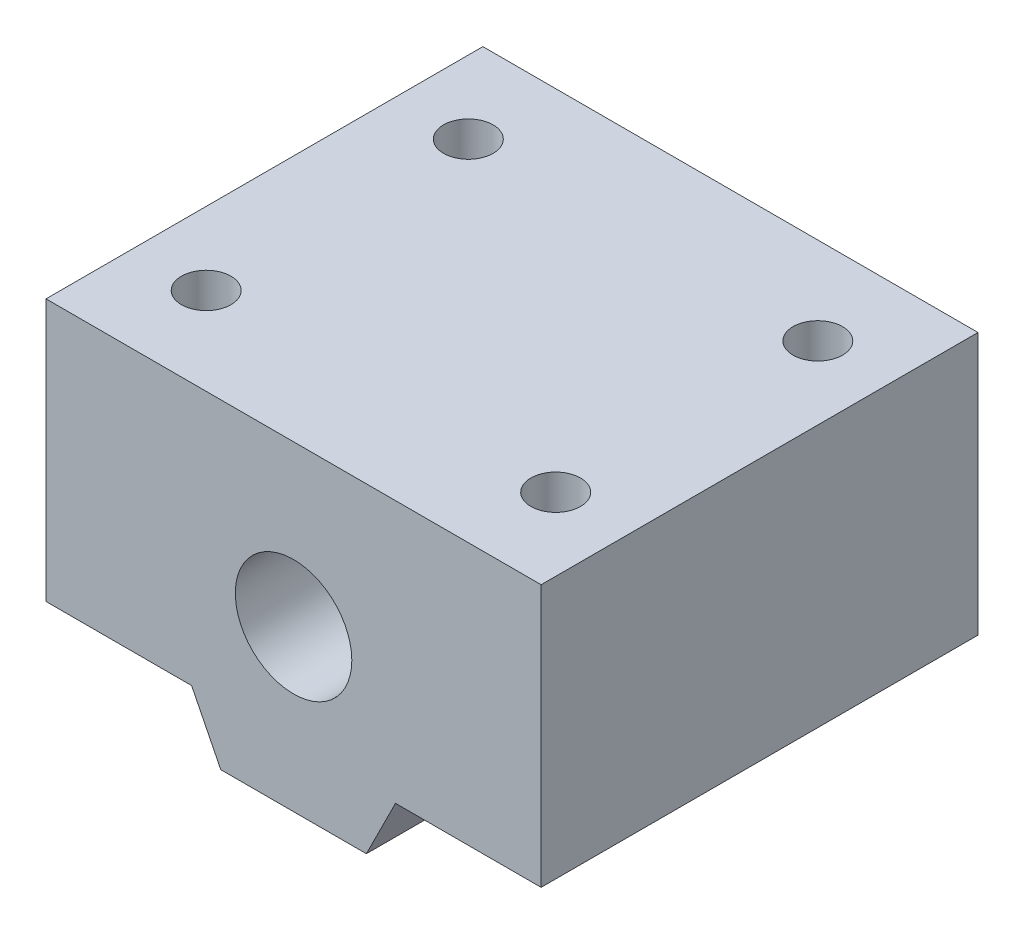
from build123d import *

# Parameters (mm, degrees)
SKETCH_1_R          = 4
EXTRUDE_1_DEPTH     = 30
SKETCH_3_R          = 1.7
CUT_EXTRUDE_1_DEPTH = 30
SKETCH_4_R          = 2
CUT_EXTRUDE_2_DEPTH = 6


with BuildPart() as part:
    # 草图1 → 凸台-拉伸1 (new body)
    with BuildSketch(Plane.XY):
        Polygon((-17, -7), (-7, -7), (-5, -11), (5, -11), (7, -7), (17, -7), (17, 11), (-17, 11), align=None)
        Circle(SKETCH_1_R, mode=Mode.SUBTRACT)
    extrude(amount=EXTRUDE_1_DEPTH)

    # 草图3 → 切除-拉伸1 (cut)
    with BuildSketch(Plane(origin=(0, 11, 0), x_dir=(1, 0, 0), z_dir=(0, 1, 0))):
        with Locations(Location((12, -6, 0), (0, 0, 270))):
            Circle(SKETCH_3_R)
        with Locations(Location((-12, -6, 0), (0, 0, 270))):
            Circle(SKETCH_3_R)
        with Locations(Location((-12, -24, 0), (0, 0, 270))):
            Circle(SKETCH_3_R)
        with Locations(Location((12, -24, 0), (0, 0, 270))):
            Circle(SKETCH_3_R)
    extrude(amount=-CUT_EXTRUDE_1_DEPTH, mode=Mode.SUBTRACT)

    # 草图4 → 切除-拉伸2 (cut)
    with BuildSketch(Plane.XZ.offset(7)):
        with Locations(Location((-12, 24, 0), (0, 0, 270))):
            Circle(SKETCH_4_R)
        with Locations(Location((12, 24, 0), (0, 0, 270))):
            Circle(SKETCH_4_R)
        with Locations(Location((12, 6, 0), (0, 0, 270))):
            Circle(SKETCH_4_R)
        with Locations(Location((-12, 6, 0), (0, 0, 270))):
            Circle(SKETCH_4_R)
    extrude(amount=-CUT_EXTRUDE_2_DEPTH, mode=Mode.SUBTRACT)


solid = part.part
